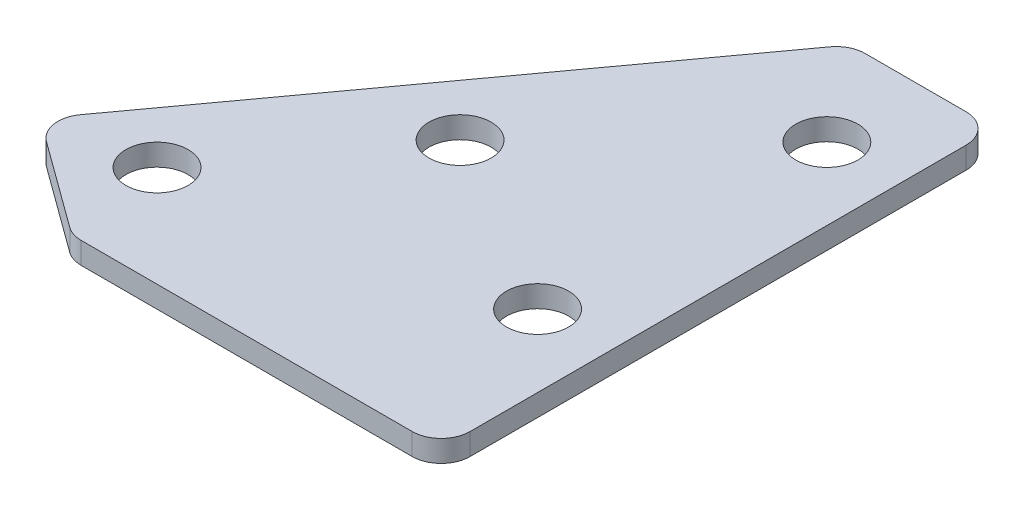
from build123d import *

# Parameters (mm, degrees)
SKETCH_1_R      = 2.15
EXTRUDE_1_DEPTH = 1.5
FILLET_1_R      = 2


with BuildPart() as part:
    # ｽｹｯﾁ1 → ﾎﾞｽ - 押し出し1 (new body)
    with BuildSketch(Plane(origin=(0, 0, 0), x_dir=(1, 0, 0), z_dir=(0, 1, 0))):
        Polygon((168.961505009, 223.33161403), (160.880196822, 229.22164442), (184.5, 261.628762236), (194.5, 261.628762236), (194.5, 223.33161403), align=None)
        with Locations(Location((176.700911695, 242.439245598, 0), (0, 0, 270))):
            Circle(SKETCH_1_R, mode=Mode.SUBTRACT)
        with Locations(Location((189.5, 235, 0), (0, 0, 270))):
            Circle(SKETCH_1_R, mode=Mode.SUBTRACT)
        with Locations(Location((167.865866111, 230.317283318, 0), (0, 0, 270))):
            Circle(SKETCH_1_R, mode=Mode.SUBTRACT)
        with Locations(Location((189.5, 255, 0), (0, 0, 270))):
            Circle(SKETCH_1_R, mode=Mode.SUBTRACT)
    extrude(amount=EXTRUDE_1_DEPTH)

    # ﾌｨﾚｯﾄ1
    fillet_1_edges = [part.edges().sort_by_distance(p)[0] for p in [
        (168.961505009, 0.75, -223.33161403),
        (160.880196822, 0.75, -229.22164442),
        (184.5, 0.75, -261.628762236),
        (194.5, 0.75, -261.628762236),
        (194.5, 0.75, -223.33161403),
    ]]
    fillet(fillet_1_edges, radius=FILLET_1_R)


solid = part.part
